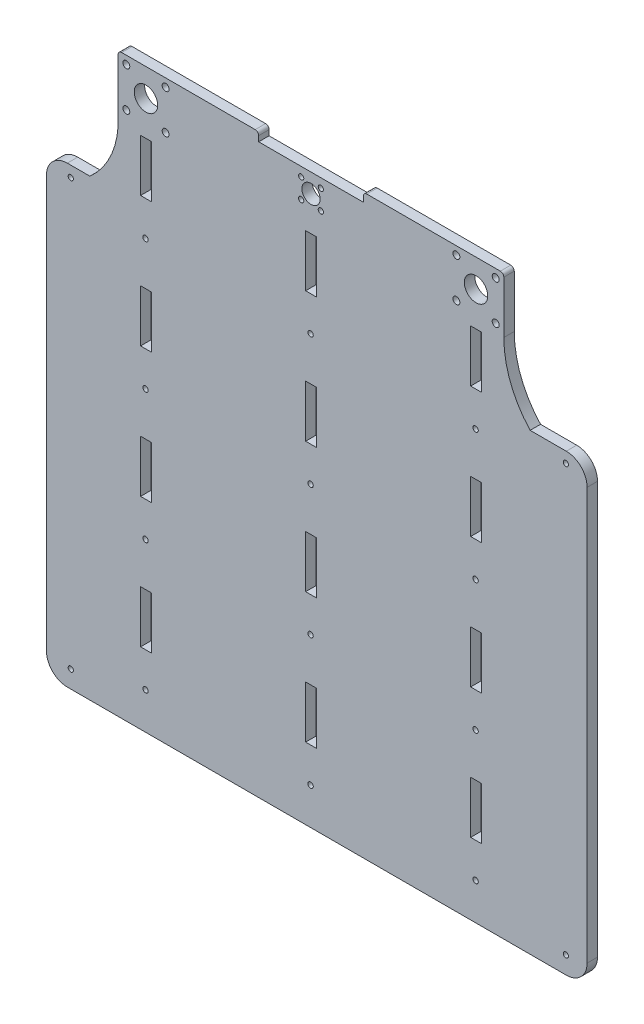
from build123d import *

# Parameters (mm, degrees)
CROQUIS1_R              = 1.5
CROQUIS1_R_2            = 1.55
CROQUIS1_W              = 6.2
CROQUIS1_H              = 30
CROQUIS1_R_3            = 2
CROQUIS1_R_4            = 6.75
CROQUIS1_R_5            = 5.25
SALIENTE_EXTRUIR1_DEPTH = 6


with BuildPart() as part:
    # Croquis1 → Saliente-Extruir1 (new body)
    with BuildSketch(Plane.XY):
        with BuildLine():
            Line((87.635637669, 16), (32.115377174, 16))
            ThreePointArc((32.115377174, 16), (30.701163612, 15.414213562), (30.115377174, 14))
            Line((30.115377174, 14), (30.115377174, 10.910010016))
            Line((30.115377174, 10.910010016), (-30.115377174, 10.910010016))
            Line((-30.115377174, 10.910010016), (-30.115377174, 14))
            ThreePointArc((-30.115377174, 14), (-30.701163612, 15.414213562), (-32.115377174, 16))
            Line((-32.115377174, 16), (-44.664398505, 16))
            Line((-44.664398505, 16), (-87.635637669, 16))
            Line((-87.635637669, 16), (-109, 16))
            ThreePointArc((-109, 16), (-110.414213562, 15.414213562), (-111, 14))
            Line((-111, 14), (-111, 0))
            Line((-111, 0), (-111, -16))
            Line((-111, -16), (-111, -16.087517131))
            ThreePointArc((-111, -16.087517131), (-114.684754838, -37.311709927), (-127.277573278, -54.789258433))
            Line((-127.277573278, -54.789258433), (-135.277573278, -54.789258433))
            Line((-135.277573278, -54.789258433), (-140.277573278, -54.789258433))
            ThreePointArc((-140.277573278, -54.789258433), (-148.762854653, -58.303977059), (-152.277573278, -66.789258433))
            Line((-152.277573278, -66.789258433), (-152.277573278, -304))
            ThreePointArc((-152.277573278, -304), (-148.762854653, -312.485281374), (-140.277573278, -316))
            Line((-140.277573278, -316), (-135.277573278, -316))
            Line((-135.277573278, -316), (-119.364295205, -316))
            Line((-119.364295205, -316), (-96, -316))
            Line((-96, -316), (-44.664398505, -316))
            Line((-44.664398505, -316), (119.364429455, -316))
            Line((119.364429455, -316), (130.295105026, -316))
            Line((130.295105026, -316), (146.942872896, -316))
            ThreePointArc((146.942872896, -316), (155.42815427, -312.485281374), (158.942872896, -304))
            Line((158.942872896, -304), (158.942872896, -70.858545673))
            Line((158.942872896, -70.858545673), (158.942872896, -66.789258433))
            ThreePointArc((158.942872896, -66.789258433), (155.42815427, -58.303977059), (146.942872896, -54.789258433))
            Line((146.942872896, -54.789258433), (126.134028278, -54.789258433))
            ThreePointArc((126.134028278, -54.789258433), (114.918041875, -36.865291264), (111, -16.087517131))
            Line((111, -16.087517131), (111, 14))
            ThreePointArc((111, 14), (110.414213562, 15.414213562), (109, 16))
            Line((109, 16), (87.635637669, 16))
        make_face()
        with Locations((-138.277573278, -306)):
            Circle(CROQUIS1_R, mode=Mode.SUBTRACT)
        with Locations((-95.239711316, -294.840181849)):
            Circle(CROQUIS1_R_2, mode=Mode.SUBTRACT)
        with Locations((-95, -259.840181849)):
            Rectangle(CROQUIS1_W, CROQUIS1_H, mode=Mode.SUBTRACT)
        with Locations((-0.239711316, -294.840181849)):
            Circle(CROQUIS1_R_2, mode=Mode.SUBTRACT)
        with Locations((0, -259.840181849)):
            Rectangle(CROQUIS1_W, CROQUIS1_H, mode=Mode.SUBTRACT)
        with Locations((-95.239711316, -219.840181849)):
            Circle(CROQUIS1_R_2, mode=Mode.SUBTRACT)
        with Locations((-95, -184.840181849)):
            Rectangle(CROQUIS1_W, CROQUIS1_H, mode=Mode.SUBTRACT)
        with Locations((-0.239711316, -219.840181849)):
            Circle(CROQUIS1_R_2, mode=Mode.SUBTRACT)
        with Locations((0, -184.840181849)):
            Rectangle(CROQUIS1_W, CROQUIS1_H, mode=Mode.SUBTRACT)
        with Locations((94.760288684, -294.840181849)):
            Circle(CROQUIS1_R_2, mode=Mode.SUBTRACT)
        with Locations((146.722426722, -306)):
            Circle(CROQUIS1_R, mode=Mode.SUBTRACT)
        with Locations((95, -259.840181849)):
            Rectangle(CROQUIS1_W, CROQUIS1_H, mode=Mode.SUBTRACT)
        with Locations((94.760288684, -219.840181849)):
            Circle(CROQUIS1_R_2, mode=Mode.SUBTRACT)
        with Locations((95, -184.840181849)):
            Rectangle(CROQUIS1_W, CROQUIS1_H, mode=Mode.SUBTRACT)
        with Locations((-95.239711316, -144.840181849)):
            Circle(CROQUIS1_R_2, mode=Mode.SUBTRACT)
        with Locations((-95, -109.840181849)):
            Rectangle(CROQUIS1_W, CROQUIS1_H, mode=Mode.SUBTRACT)
        with Locations((-95.239711316, -69.840181849)):
            Circle(CROQUIS1_R_2, mode=Mode.SUBTRACT)
        with Locations((-0.239711316, -144.840181849)):
            Circle(CROQUIS1_R_2, mode=Mode.SUBTRACT)
        with Locations((0, -109.840181849)):
            Rectangle(CROQUIS1_W, CROQUIS1_H, mode=Mode.SUBTRACT)
        with Locations((-0.239711316, -69.840181849)):
            Circle(CROQUIS1_R_2, mode=Mode.SUBTRACT)
        with Locations((-138.277573278, -61)):
            Circle(CROQUIS1_R, mode=Mode.SUBTRACT)
        with Locations((-95, -34.840181849)):
            Rectangle(CROQUIS1_W, CROQUIS1_H, mode=Mode.SUBTRACT)
        with Locations((-106.313708499, -11.313708499)):
            Circle(CROQUIS1_R_3, mode=Mode.SUBTRACT)
        with Locations((-83.686291501, -11.313708499)):
            Circle(CROQUIS1_R_3, mode=Mode.SUBTRACT)
        with Locations((-95, 0)):
            Circle(CROQUIS1_R_4, mode=Mode.SUBTRACT)
        with Locations((-106.313708499, 11.313708499)):
            Circle(CROQUIS1_R_3, mode=Mode.SUBTRACT)
        with Locations((-83.686291501, 11.313708499)):
            Circle(CROQUIS1_R_3, mode=Mode.SUBTRACT)
        with Locations((0, -34.840181849)):
            Rectangle(CROQUIS1_W, CROQUIS1_H, mode=Mode.SUBTRACT)
        with Locations((-5.656854249, -5.656854249)):
            Circle(CROQUIS1_R, mode=Mode.SUBTRACT)
        Circle(CROQUIS1_R_5, mode=Mode.SUBTRACT)
        with Locations((-5.656854249, 5.656854249)):
            Circle(CROQUIS1_R, mode=Mode.SUBTRACT)
        with Locations((94.760288684, -144.840181849)):
            Circle(CROQUIS1_R_2, mode=Mode.SUBTRACT)
        with Locations((95, -109.840181849)):
            Rectangle(CROQUIS1_W, CROQUIS1_H, mode=Mode.SUBTRACT)
        with Locations((94.760288684, -69.840181849)):
            Circle(CROQUIS1_R_2, mode=Mode.SUBTRACT)
        with Locations((5.656854249, -5.656854249)):
            Circle(CROQUIS1_R, mode=Mode.SUBTRACT)
        with Locations((5.656854249, 5.656854249)):
            Circle(CROQUIS1_R, mode=Mode.SUBTRACT)
        with Locations((95, -34.840181849)):
            Rectangle(CROQUIS1_W, CROQUIS1_H, mode=Mode.SUBTRACT)
        with Locations((146.722426722, -61)):
            Circle(CROQUIS1_R, mode=Mode.SUBTRACT)
        with Locations((83.686291501, -11.313708499)):
            Circle(CROQUIS1_R_3, mode=Mode.SUBTRACT)
        with Locations((106.313708499, -11.313708499)):
            Circle(CROQUIS1_R_3, mode=Mode.SUBTRACT)
        with Locations((95, 0)):
            Circle(CROQUIS1_R_4, mode=Mode.SUBTRACT)
        with Locations((83.686291501, 11.313708499)):
            Circle(CROQUIS1_R_3, mode=Mode.SUBTRACT)
        with Locations((106.313708499, 11.313708499)):
            Circle(CROQUIS1_R_3, mode=Mode.SUBTRACT)
    extrude(amount=SALIENTE_EXTRUIR1_DEPTH)


solid = part.part
